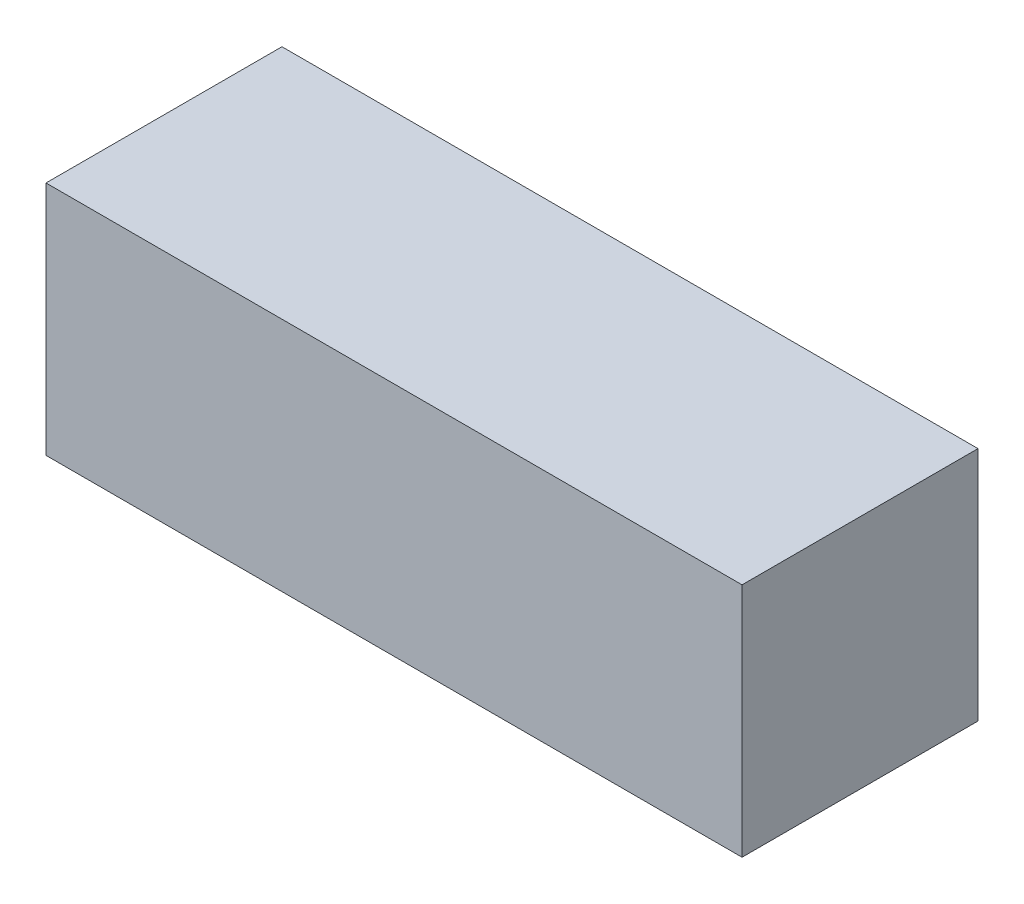
from build123d import *

# Parameters (mm, degrees)
SKETCH_1_W      = 59
SKETCH_1_H      = 20
EXTRUDE_1_DEPTH = 20


with BuildPart() as part:
    # 草图1 → 凸台-拉伸1 (new body)
    with BuildSketch(Plane(origin=(0, 0, 0), x_dir=(1, 0, 0), z_dir=(0, 1, 0))):
        Rectangle(SKETCH_1_W, SKETCH_1_H)
    extrude(amount=EXTRUDE_1_DEPTH)


solid = part.part
